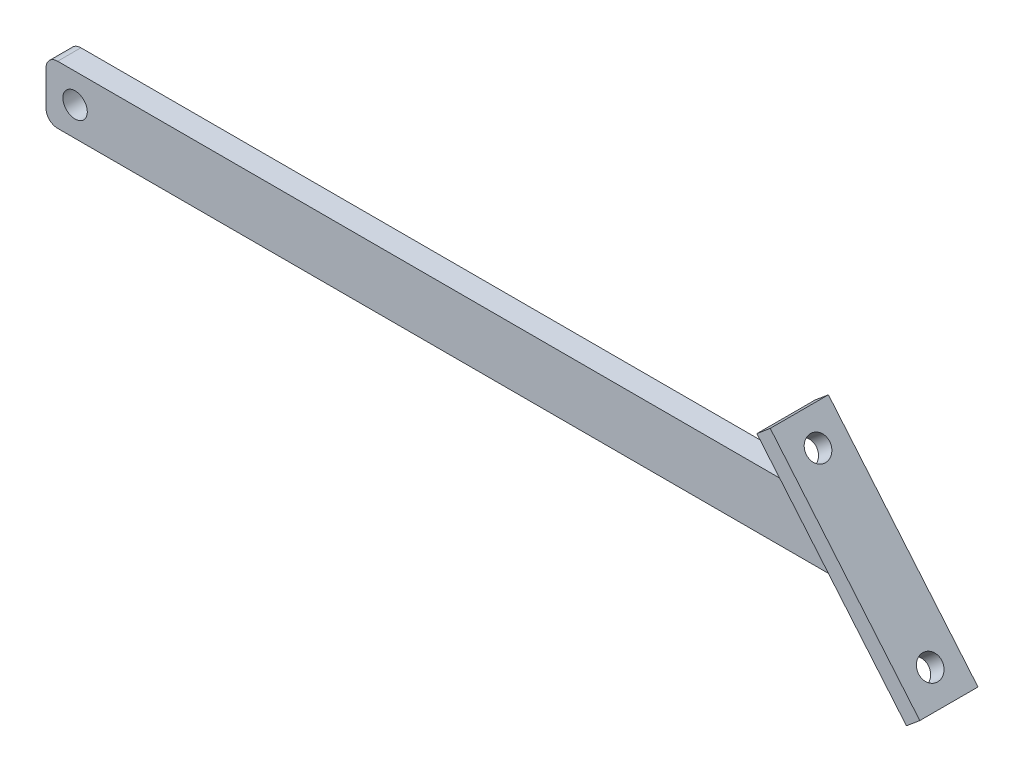
from build123d import *

# Parameters (mm, degrees)
SKETCH_1_R      = 2.1
EXTRUDE_1_DEPTH = 4
FILLET_1_R      = 2
SKETCH_2_W      = 10
SKETCH_2_H      = 40
SKETCH_2_R      = 2
EXTRUDE_2_DEPTH = 3


with BuildPart() as part:
    # 草图1 → 凸台-拉伸1 (new body)
    with BuildSketch(Plane.XY):
        Polygon((125.165745856, -4.723756906), (116.774749545, 5.276243094), (-14.834254144, 5.276243094), (-14.834254144, -4.723756906), align=None)
        with Locations((-9.834254144, 0.276243094)):
            Circle(SKETCH_1_R, mode=Mode.SUBTRACT)
    extrude(amount=EXTRUDE_1_DEPTH)

    # 圆角1
    fillet_1_edges = [part.edges().sort_by_distance(p)[0] for p in [
        (-14.834254144, 5.276243094, 2),
        (-14.834254144, -4.723756906, 2),
    ]]
    fillet(fillet_1_edges, radius=FILLET_1_R)


with BuildPart() as body_2:
    # 草图2 → 凸台-拉伸2 (new body)
    with BuildSketch(Plane(origin=(71.124278553, 59.680355902, 0), x_dir=(0, 0, -1), z_dir=(0.7660444431189745, 0.6427876096865437, 0))):
        with Locations((-2, -81.019525429)):
            Rectangle(SKETCH_2_W, SKETCH_2_H)
        with Locations(Location((-2, -66.019525429, 0), (0, 0, 90))):
            Circle(SKETCH_2_R, mode=Mode.SUBTRACT)
        with Locations(Location((-2, -96.019525429, 0), (0, 0, 90))):
            Circle(SKETCH_2_R, mode=Mode.SUBTRACT)
    extrude(amount=EXTRUDE_2_DEPTH)


solid = Compound([part.part, body_2.part])
